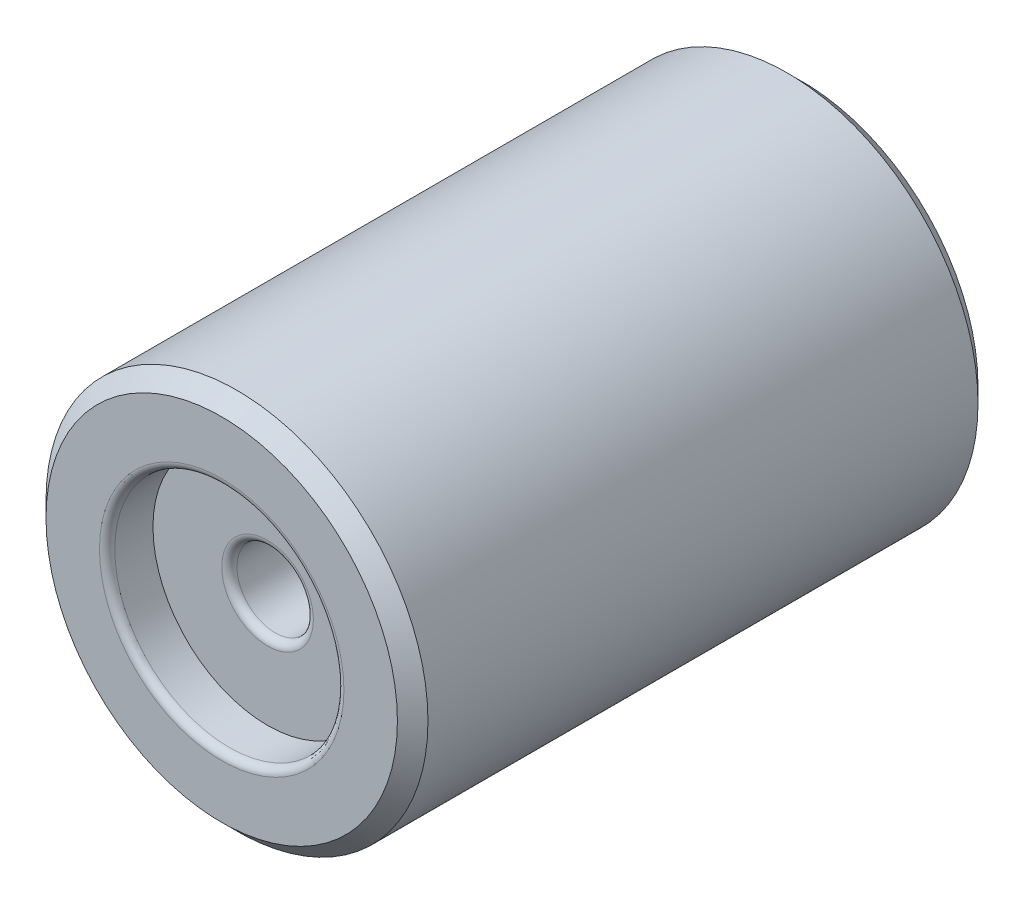
from build123d import *

# Parameters (mm, degrees)
SKETCH1_R           = 12.5
SKETCH1_R_2         = 7.5
BOSS_EXTRUDE2_DEPTH = 19
SKETCH1_4_R         = 7.5
SKETCH1_4_R_2       = 2.5
BOSS_EXTRUDE3_DEPTH = 16
CHAMFER1_SIZE       = 1
FILLET1_R           = 0.5
FILLET2_R           = 0.5


with BuildPart() as part:
    # Sketch1 → Boss-Extrude2 (new, symmetric)
    with BuildSketch(Plane.XY):
        Circle(SKETCH1_R)
        Circle(SKETCH1_R_2, mode=Mode.SUBTRACT)
    extrude(amount=BOSS_EXTRUDE2_DEPTH, both=True)

    # Sketch1<4> → Boss-Extrude3 (add, symmetric)
    with BuildSketch(Plane.XY):
        Circle(SKETCH1_4_R)
        Circle(SKETCH1_4_R_2, mode=Mode.SUBTRACT)
    extrude(amount=BOSS_EXTRUDE3_DEPTH, both=True)

    # Chamfer1
    chamfer1_edges = [part.edges().sort_by_distance(p)[0] for p in [
        (-12.5, 0, 19),
        (-12.5, 0, -19),
    ]]
    chamfer(chamfer1_edges, length=CHAMFER1_SIZE)

    # Fillet1
    fillet1_edges = [part.edges().sort_by_distance(p)[0] for p in [
        (-2.5, 0, -16),
        (-7.5, 0, -16),
        (-7.5, 0, -19),
        (-7.5, 0, 19),
    ]]
    fillet(fillet1_edges, radius=FILLET1_R)

    # Fillet2
    fillet2_edges = [part.edges().sort_by_distance(p)[0] for p in [
        (-2.5, 0, 16),
    ]]
    fillet(fillet2_edges, radius=FILLET2_R)


solid = part.part
